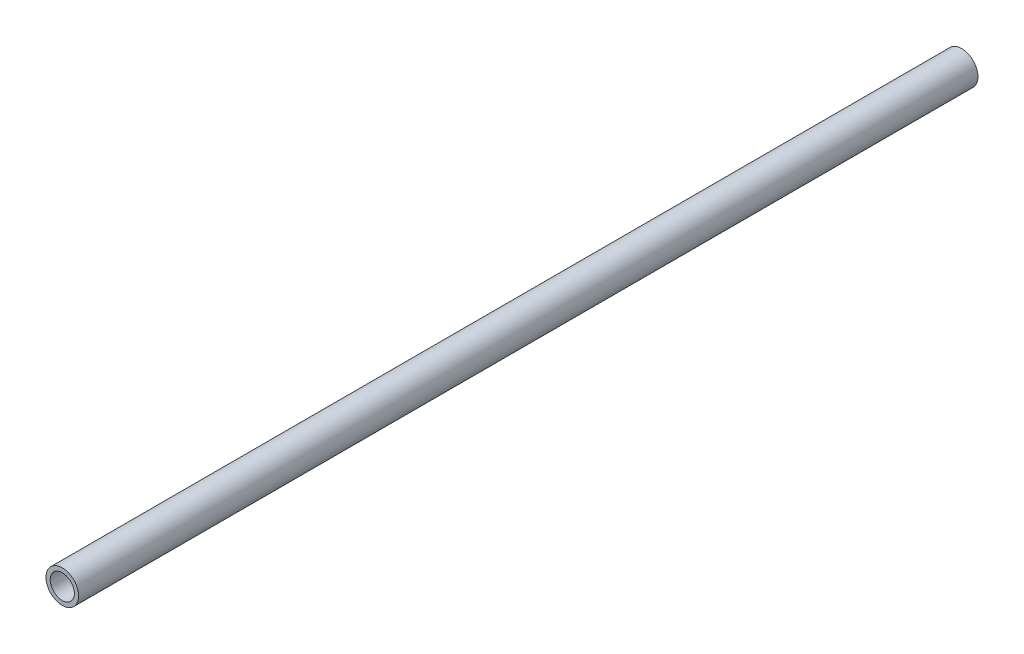
from build123d import *

# Parameters (mm, degrees)
SKETCH1_R           = 6.35
SKETCH1_R_2         = 4.699
BOSS_EXTRUDE1_DEPTH = 350


with BuildPart() as part:
    # Sketch1 → Boss-Extrude1 (new body)
    with BuildSketch(Plane.XY):
        Circle(SKETCH1_R)
        Circle(SKETCH1_R_2, mode=Mode.SUBTRACT)
    extrude(amount=-BOSS_EXTRUDE1_DEPTH)


solid = part.part
